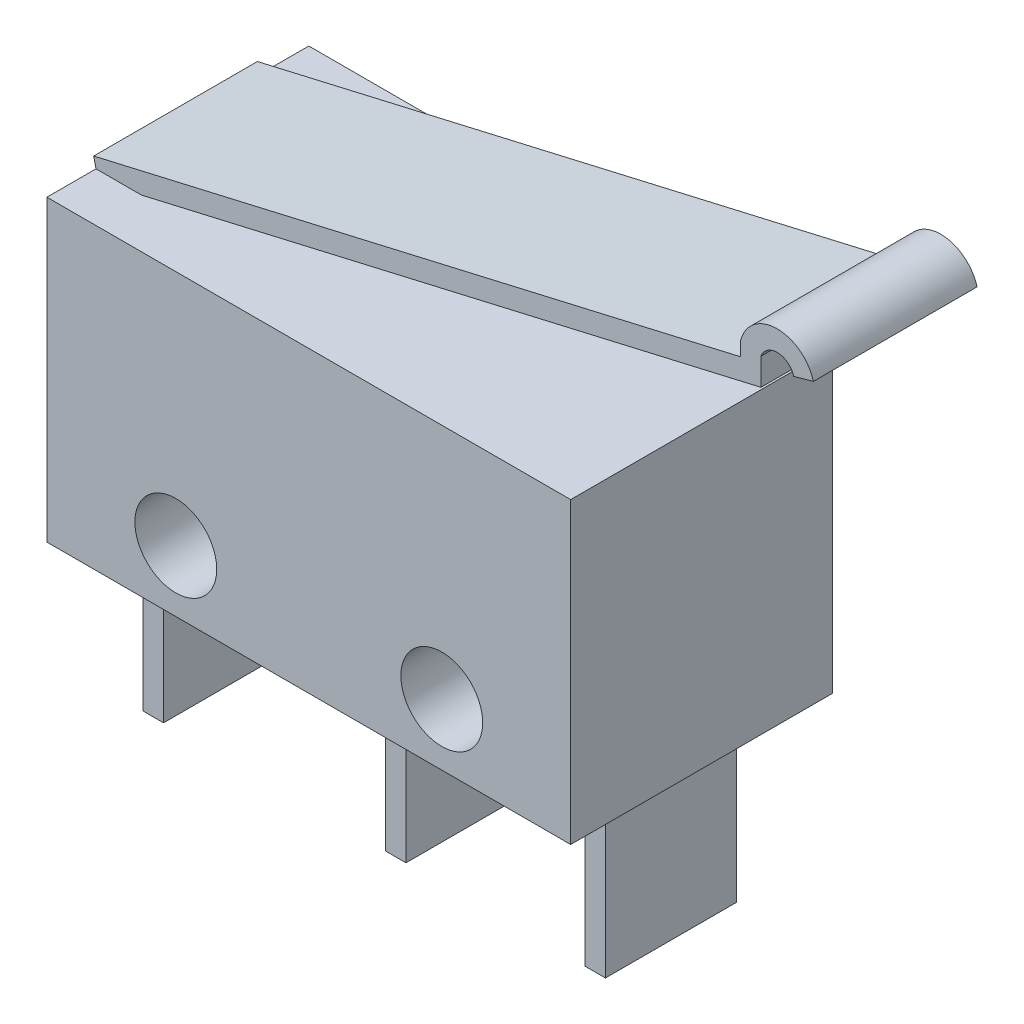
from build123d import *

# Parameters (mm, degrees)
SKETCH_1_W        = 12.8
SKETCH_1_H        = 7.3
SKETCH_1_R        = 1
EXTRUDE_1_DEPTH   = 3.2
SKETCH_2_W        = 0.5
SKETCH_2_H        = 3.2
EXTRUDE_1_2_DEPTH = 4
EXTRUDE_2_DEPTH   = 2


with BuildPart() as part:
    # Эскиз1 → Extrude 1 (new, symmetric)
    with BuildSketch(Plane.XY):
        with Locations((-6.4, 3.65)):
            Rectangle(SKETCH_1_W, SKETCH_1_H)
        with Locations((-9.65, 1.5)):
            Circle(SKETCH_1_R, mode=Mode.SUBTRACT)
        with Locations(Location((-3.15, 1.5, 0), (0, 0, 180))):
            Circle(SKETCH_1_R, mode=Mode.SUBTRACT)
    extrude(amount=EXTRUDE_1_DEPTH, both=True)

    # Эскиз2 → Extrude 1 2 (add)
    with BuildSketch(Plane.XZ):
        with Locations((-11.8, 0)):
            Rectangle(SKETCH_2_W, SKETCH_2_H)
        with Locations((-5.874787357, 0)):
            Rectangle(SKETCH_2_W, SKETCH_2_H)
        with Locations((-1, 0)):
            Rectangle(SKETCH_2_W, SKETCH_2_H)
    extrude(amount=EXTRUDE_1_2_DEPTH)

    # Эскиз3 → Вытянуть-Тонкостенный2 (add, symmetric)
    with BuildSketch(Plane.XY):
        with BuildLine():
            Line((-12.743673948, 7.056427884), (3.45, 10.801214984))
            Line((3.45, 10.801214984), (3.45, 11.461328502))
            ThreePointArc((3.45, 11.461328502), (3.861060305, 11.738598826), (4.25086812, 11.432168941))
            Line((4.25086812, 11.432168941), (4.732112122, 11.567831059))
            ThreePointArc((4.732112122, 11.567831059), (3.827123632, 12.23868926), (2.95, 11.531788258))
            Line((2.95, 11.531788258), (2.95, 11.198785016))
            Line((2.95, 11.198785016), (-12.856326052, 7.543572116))
            Line((-12.856326052, 7.543572116), (-12.743673948, 7.056427884))
        make_face()
    extrude(amount=EXTRUDE_2_DEPTH, both=True)


solid = part.part
